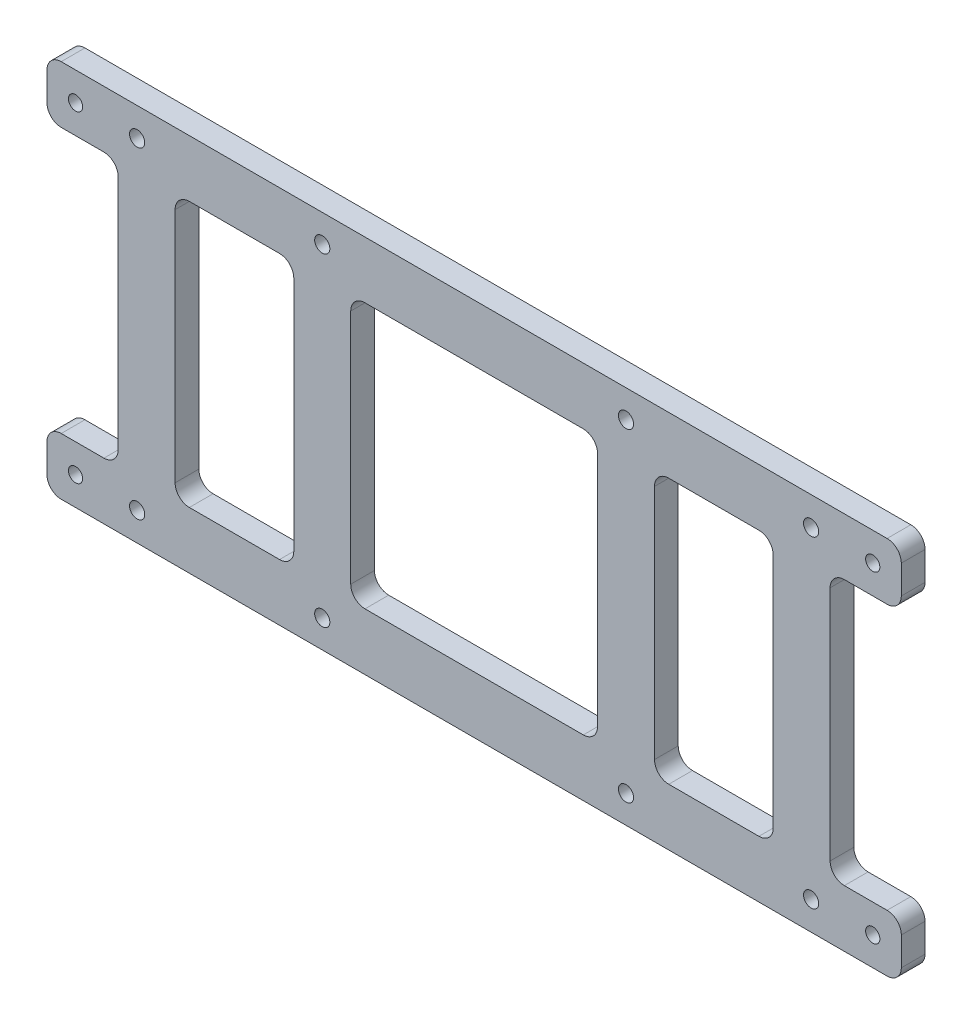
from build123d import *

# Parameters (mm, degrees)
EXTRUDE_1_DEPTH     = 5
FILLET_1_R          = 3
SKETCH_2_R          = 1.5
SKETCH_2_R_2        = 1.6
CUT_EXTRUDE_1_DEPTH = 7
SKETCH_3_W          = 12
SKETCH_3_H          = 55.843243592
EXTRUDE_2_DEPTH     = 5
FILLET_2_R          = 3


with BuildPart() as part:
    # 草图1 → 凸台-拉伸1 (new body)
    with BuildSketch(Plane.XY):
        with BuildLine():
            Line((-20, 39.843243592), (154, 39.843243592))
            ThreePointArc((154, 39.843243592), (156.121320344, 38.964563935), (157, 36.843243592))
            Line((157, 36.843243592), (157, 30.843243592))
            ThreePointArc((157, 30.843243592), (156.121320344, 28.721923248), (154, 27.843243592))
            Line((154, 27.843243592), (142, 27.843243592))
            Line((142, 27.843243592), (142, -28))
            Line((142, -28), (154, -28))
            ThreePointArc((154, -28), (156.121320344, -28.878679656), (157, -31))
            Line((157, -31), (157, -37))
            ThreePointArc((157, -37), (156.121320344, -39.121320344), (154, -40))
            Line((154, -40), (-20, -40))
            ThreePointArc((-20, -40), (-22.121320344, -39.121320344), (-23, -37))
            Line((-23, -37), (-23, -31))
            ThreePointArc((-23, -31), (-22.121320344, -28.878679656), (-20, -28))
            Line((-20, -28), (-8, -28))
            Line((-8, -28), (-8, 27.843243592))
            Line((-8, 27.843243592), (-20, 27.843243592))
            ThreePointArc((-20, 27.843243592), (-22.121320344, 28.721923248), (-23, 30.843243592))
            Line((-23, 30.843243592), (-23, 36.843243592))
            ThreePointArc((-23, 36.843243592), (-22.121320344, 38.964563935), (-20, 39.843243592))
        make_face()
        with BuildLine():
            ThreePointArc((7, 27.843243592), (4.878679656, 26.964563935), (4, 24.843243592))
            Line((4, 24.843243592), (4, -25))
            ThreePointArc((4, -25), (4.878679656, -27.121320344), (7, -28))
            Line((7, -28), (127, -28))
            ThreePointArc((127, -28), (129.121320344, -27.121320344), (130, -25))
            Line((130, -25), (130, 24.843243592))
            ThreePointArc((130, 24.843243592), (129.121320344, 26.964563935), (127, 27.843243592))
            Line((127, 27.843243592), (7, 27.843243592))
        make_face(mode=Mode.SUBTRACT)
    extrude(amount=EXTRUDE_1_DEPTH)

    # 圆角1
    fillet_1_edges = [part.edges().sort_by_distance(p)[0] for p in [
        (142, 27.843243592, 2.5),
        (142, -28, 2.5),
        (-8, -28, 2.5),
        (-8, 27.843243592, 2.5),
    ]]
    fillet(fillet_1_edges, radius=FILLET_1_R)

    # 草图2 → 切除-拉伸1 (cut)
    with BuildSketch(Plane.XY.offset(5)):
        with Locations((-16.977965312, 33.843243592)):
            Circle(SKETCH_2_R)
        with Locations((-4, 33.843243592)):
            Circle(SKETCH_2_R_2)
        with Locations((35.001599808, 34)):
            Circle(SKETCH_2_R_2)
        with Locations((98.998400192, 34)):
            Circle(SKETCH_2_R_2)
        with Locations((138, 33.843243592)):
            Circle(SKETCH_2_R_2)
        with Locations((150.977965312, 33.843243592)):
            Circle(SKETCH_2_R)
        with Locations((150.977965312, -34)):
            Circle(SKETCH_2_R)
        with Locations((138, -34)):
            Circle(SKETCH_2_R_2)
        with Locations((98.998400192, -34.156756408)):
            Circle(SKETCH_2_R_2)
        with Locations((35.001599808, -34.156756408)):
            Circle(SKETCH_2_R_2)
        with Locations((-4, -34)):
            Circle(SKETCH_2_R_2)
        with Locations((-16.977965312, -34)):
            Circle(SKETCH_2_R)
    extrude(amount=-CUT_EXTRUDE_1_DEPTH, mode=Mode.SUBTRACT)

    # 草图3 → 凸台-拉伸2 (add)
    with BuildSketch(Plane(origin=(0, 0, 0), x_dir=(-1, 0, 0), z_dir=(0, 0, -1))):
        with Locations((-98.998400192, -0.078378204)):
            Rectangle(SKETCH_3_W, SKETCH_3_H)
        with Locations((-35.001599808, -0.078378204)):
            Rectangle(SKETCH_3_W, SKETCH_3_H)
    extrude(amount=-EXTRUDE_2_DEPTH)

    # 圆角2
    fillet_2_edges = [part.edges().sort_by_distance(p)[0] for p in [
        (104.998400192, -28, 2.5),
        (104.998400192, 27.843243592, 2.5),
        (92.998400192, 27.843243592, 2.5),
        (92.998400192, -28, 2.5),
        (41.001599808, -28, 2.5),
        (41.001599808, 27.843243592, 2.5),
        (29.001599808, 27.843243592, 2.5),
        (29.001599808, -28, 2.5),
    ]]
    fillet(fillet_2_edges, radius=FILLET_2_R)


solid = part.part
